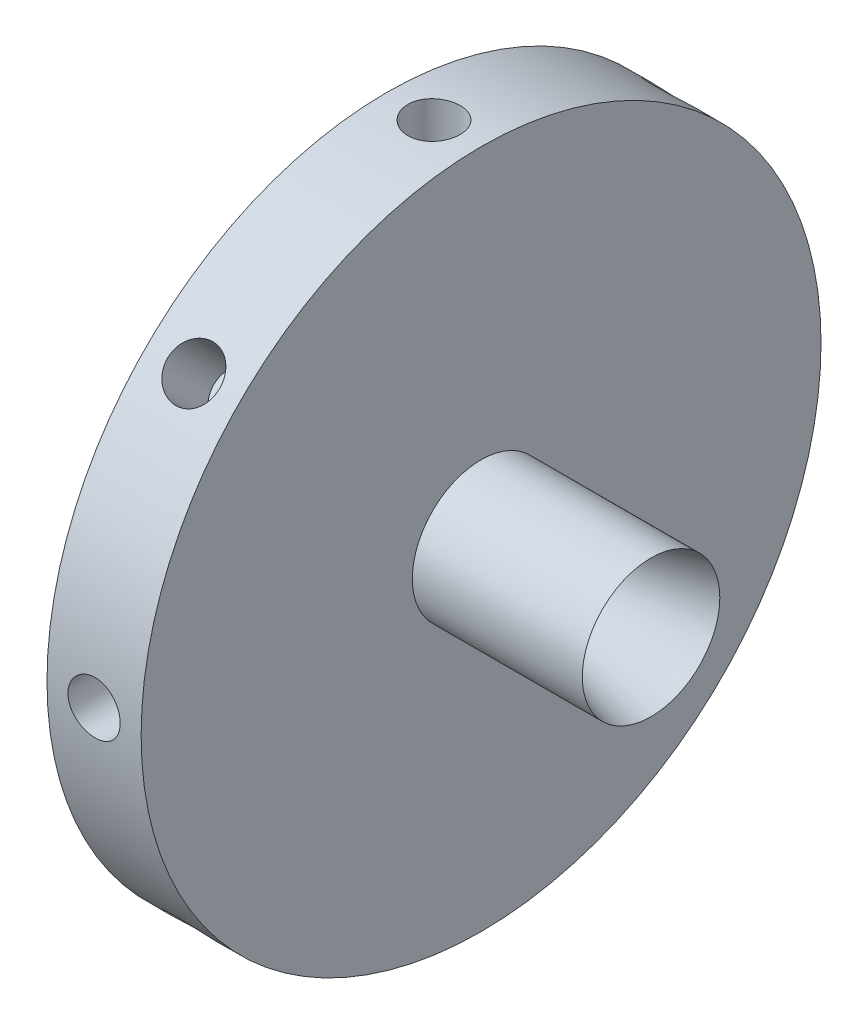
from build123d import *

# Parameters (mm, degrees)
SKETCH2_R          = 2
CUT_EXTRUDE1_DEPTH = 5
CIRPATTERN1_COUNT  = 8


with BuildPart() as part:
    # Sketch1 → Revolve2 (revolve)
    with BuildSketch(Plane.XY, mode=Mode.PRIVATE) as revolve2_sk:
        Polygon((7.2, 26), (0, 26), (0, 18), (6.2, 2), (7.2, 2), (20.2, 5.26), (7.2, 5.26), align=None)
    revolve(revolve2_sk.sketch.rotate(Axis((20.2, 0, 0), (-1, 0, 0)), 90), axis=Axis((20.2, 0, 0), (-1, 0, 0)))

    # Sketch2 → Cut-Extrude1 (cut)
    with BuildSketch(Plane(origin=(0, 0, -26), x_dir=(-1, 0, 0), z_dir=(0, 0, -1))):
        with Locations((-3.6, 0)):
            Circle(SKETCH2_R)
    cut_extrude1 = extrude(amount=-CUT_EXTRUDE1_DEPTH, mode=Mode.SUBTRACT)

    # CirPattern1: Cut-Extrude1 ×8 about axis
    cirpattern1_axis = Axis((0, 0, 0), (1, 0, 0))
    for i in range(1, CIRPATTERN1_COUNT):
        add(cut_extrude1.rotate(cirpattern1_axis, i * 360 / CIRPATTERN1_COUNT), mode=Mode.SUBTRACT)


solid = part.part
